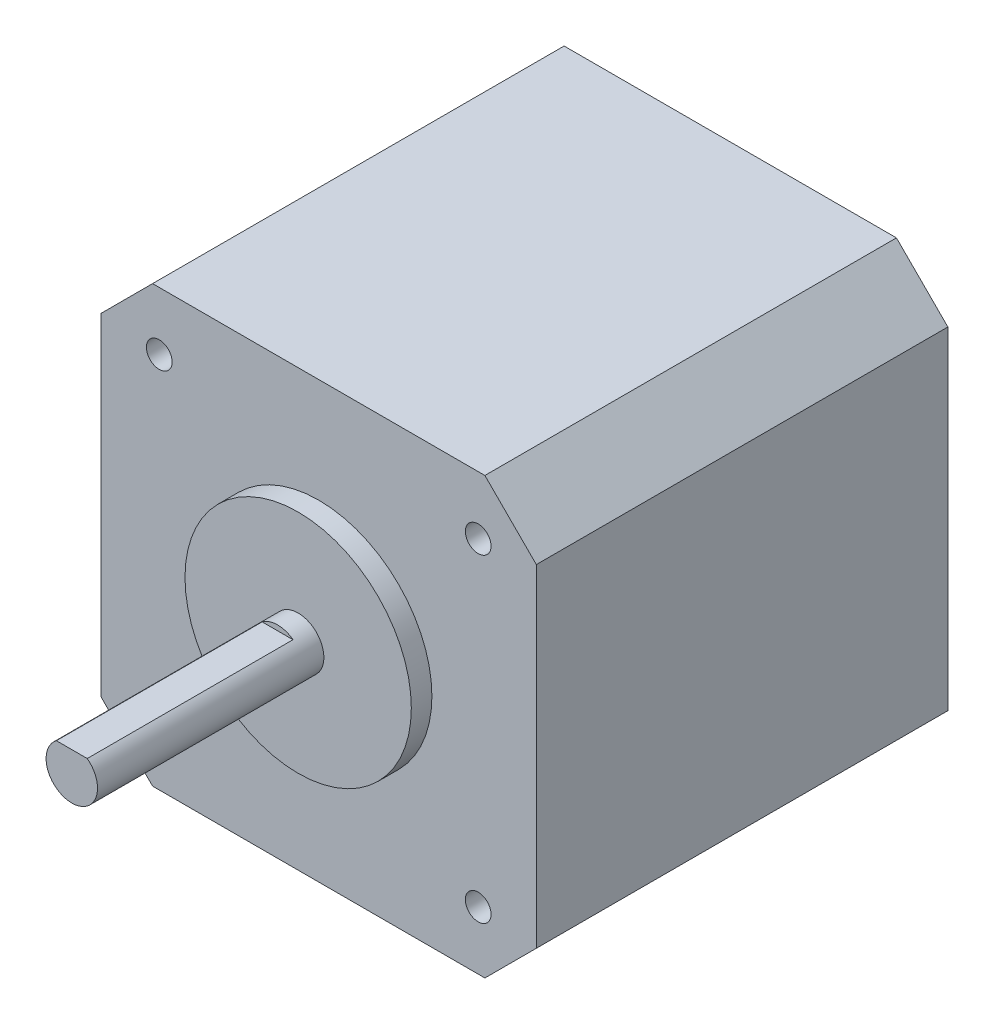
from build123d import *

# Parameters (mm, degrees)
SKIZZE1_W                       = 42.3
SKIZZE1_H                       = 42.3
AUFSATZ_LINEAR_AUSTRAGEN1_DEPTH = 40
SKIZZE2_R                       = 11
AUFSATZ_LINEAR_AUSTRAGEN2_DEPTH = 2
SKIZZE3_R                       = 2.5
AUFSATZ_LINEAR_AUSTRAGEN3_DEPTH = 22
SKIZZE4_W                       = 5
SKIZZE4_H                       = 0.5
SCHNITT_LINEAR_AUSTRAGEN1_DEPTH = 20
M3_GEWINDEBOHRUNG2_D            = 2.5
M3_GEWINDEBOHRUNG2_DEPTH        = 8.5
M3_GEWINDEBOHRUNG2_TIP          = 0.751075774
FASE6_SIZE                      = 5


with BuildPart() as part:
    # Skizze1 → Aufsatz-Linear austragen1 (new body)
    with BuildSketch(Plane.XY):
        with Locations((0.382196485, -6.777376721)):
            Rectangle(SKIZZE1_W, SKIZZE1_H)
    extrude(amount=AUFSATZ_LINEAR_AUSTRAGEN1_DEPTH)

    # Skizze2 → Aufsatz-Linear austragen2 (add)
    with BuildSketch(Plane.XY.offset(40)):
        with Locations((0.382196485, -6.777376721)):
            Circle(SKIZZE2_R)
    extrude(amount=AUFSATZ_LINEAR_AUSTRAGEN2_DEPTH)

    # Skizze3 → Aufsatz-Linear austragen3 (add)
    with BuildSketch(Plane.XY.offset(42)):
        with Locations((0.382196485, -6.777376721)):
            Circle(SKIZZE3_R)
    extrude(amount=AUFSATZ_LINEAR_AUSTRAGEN3_DEPTH)

    # Skizze4 → Schnitt-Linear austragen1 (cut)
    with BuildSketch(Plane.XY.offset(64)):
        with Locations((0.382196485, -4.527376721)):
            Rectangle(SKIZZE4_W, SKIZZE4_H)
    extrude(amount=-SCHNITT_LINEAR_AUSTRAGEN1_DEPTH, mode=Mode.SUBTRACT)

    # M3 Gewindebohrung2
    with Locations(Plane.XY.offset(40)):
        with Locations((-15.117803515, 8.722623279), (15.882196485, 8.722623279), (-15.117803515, -22.277376721), (15.882196485, -22.277376721)):
            Hole(M3_GEWINDEBOHRUNG2_D / 2, depth=M3_GEWINDEBOHRUNG2_DEPTH)
            with Locations((0, 0, -(M3_GEWINDEBOHRUNG2_DEPTH + M3_GEWINDEBOHRUNG2_TIP / 2))):  # 118° drill point
                Cone(0, M3_GEWINDEBOHRUNG2_D / 2, M3_GEWINDEBOHRUNG2_TIP, mode=Mode.SUBTRACT)

    # Fase6
    fase6_edges = [part.edges().sort_by_distance(p)[0] for p in [
        (-20.767803515, 14.372623279, 20),
        (21.532196485, 14.372623279, 20),
        (21.532196485, -27.927376721, 20),
        (-20.767803515, -27.927376721, 20),
    ]]
    chamfer(fase6_edges, length=FASE6_SIZE)


solid = part.part
